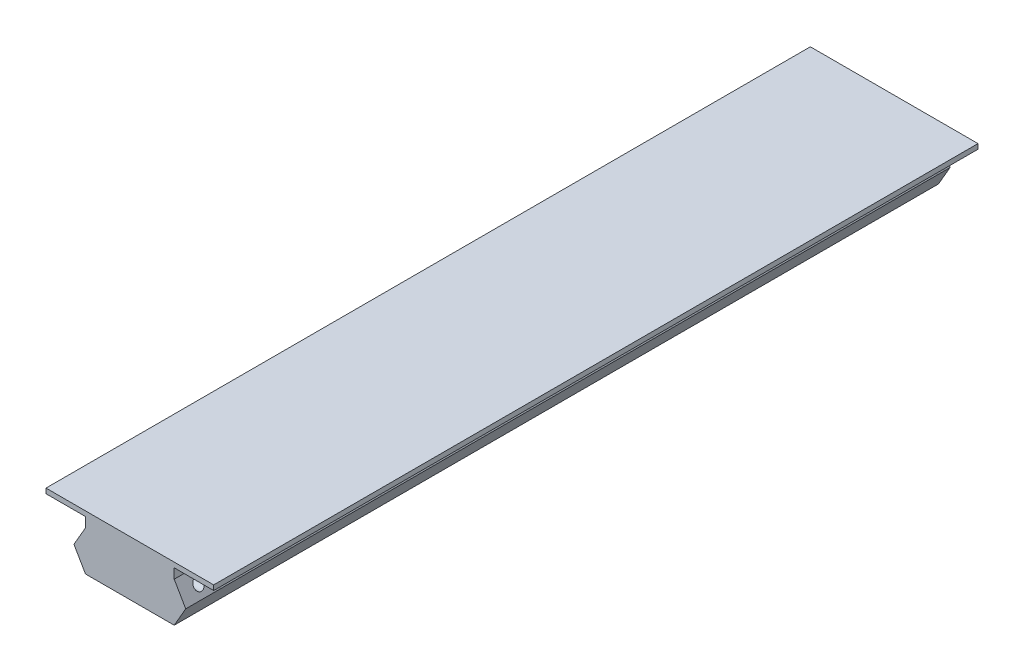
from build123d import *

# Parameters (mm, degrees)
BOSS_EXTRUDE1_DEPTH = 155
SKETCH2_R           = 1
CUT_EXTRUDE1_DEPTH  = 157.400131162
LPATTERN1_COUNT     = 41
LPATTERN1_PITCH     = 3.71


with BuildPart() as part:
    # Sketch1 → Boss-Extrude1 (new body)
    with BuildSketch(Plane.XY):
        Polygon((9.693000417, 0), (-8.306999583, 0), (-10.641999583, 4.044338636), (-8.306999583, 8.088677271), (-8.306999583, 10.088677271), (-16.306999583, 10.088677271), (-16.306999583, 11.088677271), (17.693000417, 11.088677271), (17.693000417, 10.088677271), (9.693000417, 10.088677271), (9.693000417, 8.088677271), (12.028000417, 4.044338636), align=None)
    extrude(amount=-BOSS_EXTRUDE1_DEPTH)

    # Sketch2 → Cut-Extrude1 (cut, symmetric)
    with BuildSketch(Plane(origin=(0, 0, 0), x_dir=(0, 0, -1), z_dir=(1, 0, 0))):
        with Locations(Location((3.71, 5.988677271, 0), (0, 0, 90))):
            Circle(SKETCH2_R)
    cut_extrude1 = extrude(amount=CUT_EXTRUDE1_DEPTH, both=True, mode=Mode.SUBTRACT)

    # LPattern1: Cut-Extrude1 ×41
    with Locations(*[(0, 0, -i * LPATTERN1_PITCH) for i in range(1, LPATTERN1_COUNT)]):
        add(cut_extrude1, mode=Mode.SUBTRACT)


solid = part.part
